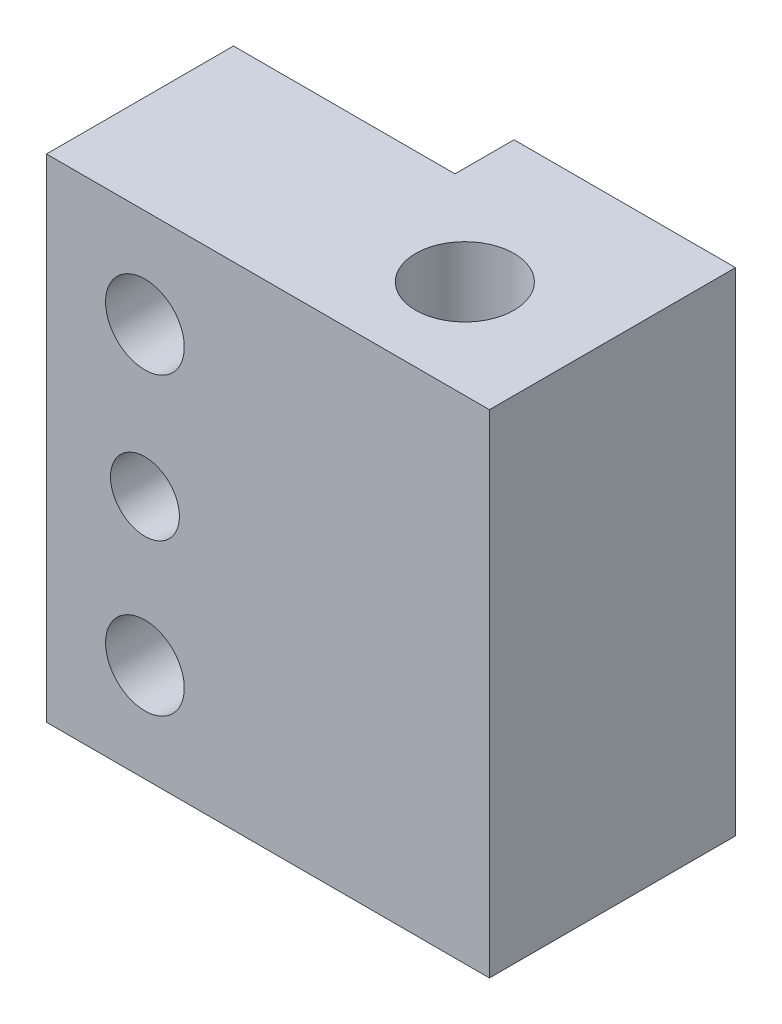
from build123d import *

# Parameters (mm, degrees)
SKETCH1_R           = 1
BOSS_EXTRUDE1_DEPTH = 10
SKETCH5_R           = 0.7
SKETCH5_R_2         = 0.8
SKETCH5_R_3         = 2
CUT_EXTRUDE3_DEPTH  = 23.681269806
SKETCH7_W           = 11
SKETCH7_H           = 15.934078747
CUT_EXTRUDE4_DEPTH  = 23.681269806


with BuildPart() as part:
    # Sketch1 → Boss-Extrude1 (new body)
    with BuildSketch(Plane(origin=(0, 0, 0), x_dir=(1, 0, 0), z_dir=(0, 1, 0))):
        Polygon((0, 0), (20, 0), (20, 5), (15.5, 5), (15.5, 3.8), (0, 3.8), align=None)
        with Locations(Location((2.5, 2, 0), (0, 0, 270))):
            Circle(SKETCH1_R, mode=Mode.SUBTRACT)
        with Locations(Location((17.5, 2, 0), (0, 0, 270))):
            Circle(SKETCH1_R, mode=Mode.SUBTRACT)
    extrude(amount=BOSS_EXTRUDE1_DEPTH)

    # Sketch5 → Cut-Extrude3 (cut, through all)
    with BuildSketch(Plane(origin=(0, 0, -3.8), x_dir=(-1, 0, 0), z_dir=(0, 0, -1))):
        with Locations((-13, 4.971794193)):
            Circle(SKETCH5_R)
        with Locations((-13, 8)):
            Circle(SKETCH5_R_2)
        with Locations((-6.5, 4)):
            Circle(SKETCH5_R_3)
        with Locations((-13, 2)):
            Circle(SKETCH5_R_2)
    extrude(amount=-CUT_EXTRUDE3_DEPTH, mode=Mode.SUBTRACT)

    # Sketch7 → Cut-Extrude4 (cut, through all)
    with BuildSketch(Plane(origin=(0, 0, -3.8), x_dir=(-1, 0, 0), z_dir=(0, 0, -1))):
        with Locations((-5.5, 5.758979145)):
            Rectangle(SKETCH7_W, SKETCH7_H)
    extrude(amount=-CUT_EXTRUDE4_DEPTH, mode=Mode.SUBTRACT)


solid = part.part
